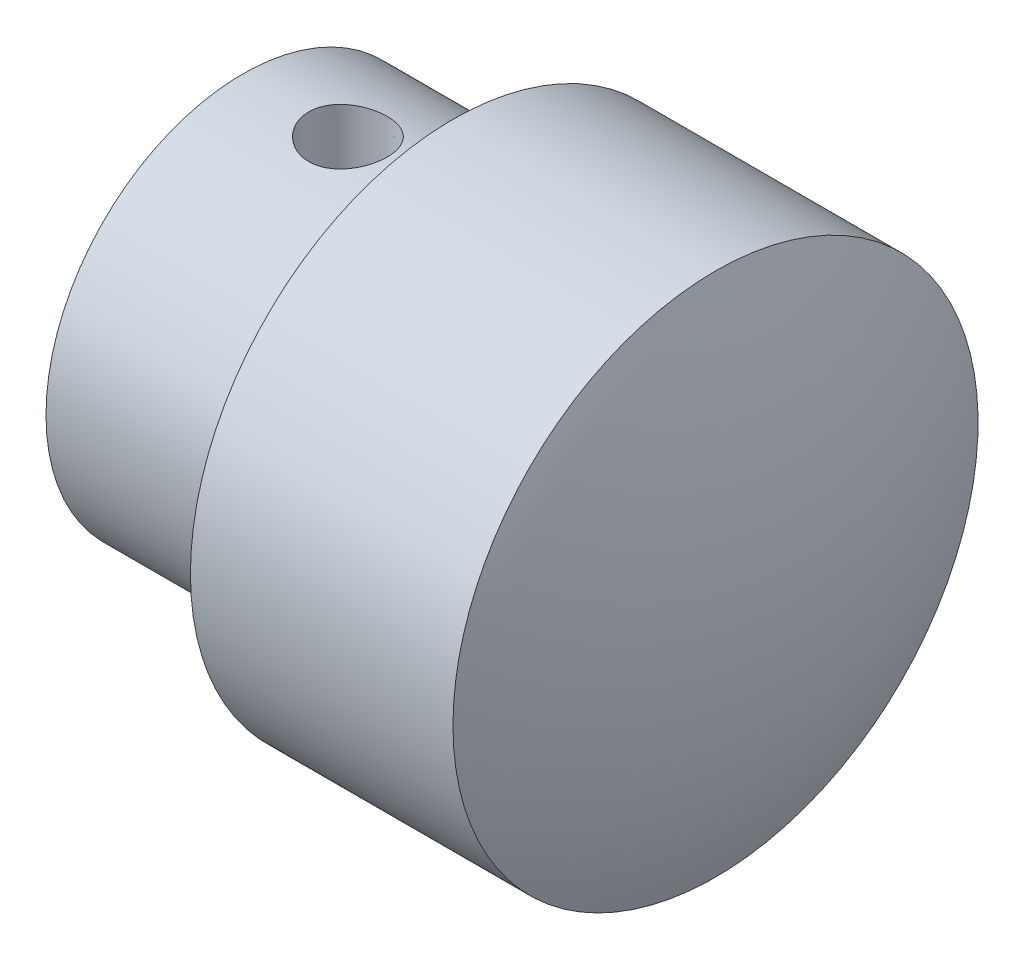
from build123d import *

# Parameters (mm, degrees)
F_8_0MM_1_D     = 8
F_8_0MM_1_DEPTH = 8
F_8_0MM_1_TIP   = 2.403442476


with BuildPart() as part:
    # 草图1 → 旋转1 (revolve)
    with BuildSketch(Plane.XY, mode=Mode.PRIVATE) as revolve_1_sk:
        with BuildLine():
            Line((0, 0), (0, 7.5))
            Line((0, 7.5), (8, 7.5))
            Line((8, 7.5), (8, 10))
            Line((8, 10), (18, 10))
            ThreePointArc((18, 10), (19.559779348, 5.107741092), (20.087121525, 0))
            Line((20.087121525, 0), (0, 0))
        make_face()
    revolve(revolve_1_sk.sketch.rotate(Axis((0, 0, 0), (1, 0, 0)), 90), axis=Axis((0, 0, 0), (1, 0, 0)))

    # Ø8.0mm 暗销孔1
    with Locations(Plane.ZY):
        with Locations((0, 0)):
            Hole(F_8_0MM_1_D / 2, depth=F_8_0MM_1_DEPTH)
            with Locations((0, 0, -(F_8_0MM_1_DEPTH + F_8_0MM_1_TIP / 2))):  # 118° drill point
                Cone(0, F_8_0MM_1_D / 2, F_8_0MM_1_TIP, mode=Mode.SUBTRACT)

    # 草图4 → 切除-旋转1 (revolve, cut)
    with BuildSketch(Plane.XY, mode=Mode.PRIVATE) as cut_revolve_1_sk:
        Polygon((4, -8.895136949), (5.4, -8.895136949), (5.5, 8.719380104), (4, 8.719380104), align=None)
    revolve(cut_revolve_1_sk.sketch.rotate(Axis((4, 18.564015212, 0), (0, -1, 0)), 226.690648884), axis=Axis((4, 18.564015212, 0), (0, -1, 0)), mode=Mode.SUBTRACT)


solid = part.part
